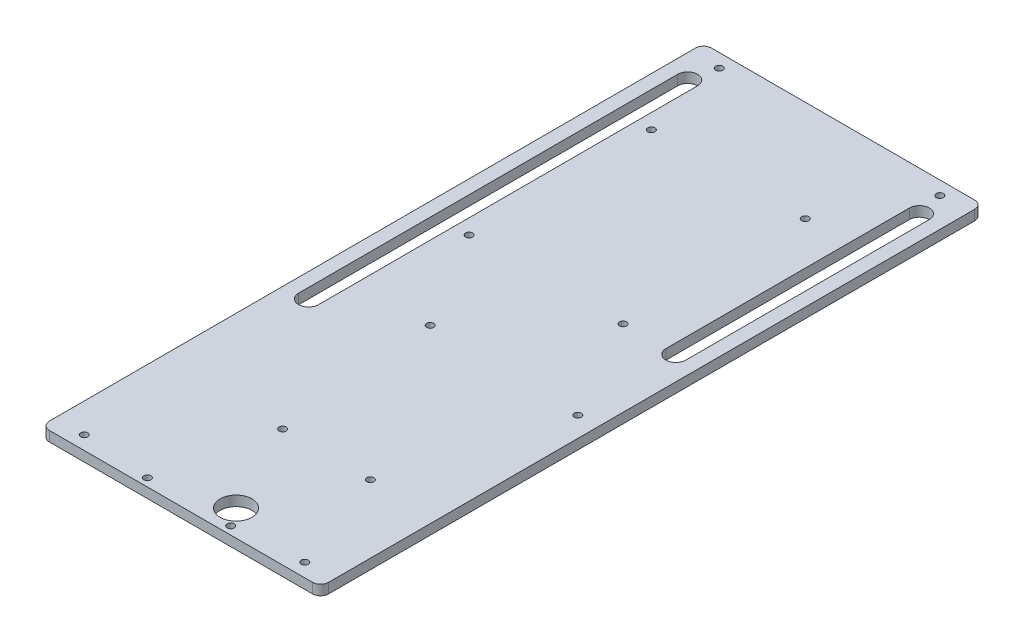
from build123d import *

# Parameters (mm, degrees)
SKETCH2_W           = 88.9
SKETCH2_H           = 3.2004
BOSS_EXTRUDE1_DEPTH = 210.82
SKETCH3_R           = 1.1303
SKETCH3_R_2         = 5.08
CUT_EXTRUDE1_DEPTH  = 216.82004684
FILLET2_R           = 2.54


with BuildPart() as part:
    # Sketch2 → Boss-Extrude1 (new body)
    with BuildSketch(Plane.XY):
        with Locations((-1.625781684, -22.993244248)):
            Rectangle(SKETCH2_W, SKETCH2_H)
    extrude(amount=BOSS_EXTRUDE1_DEPTH)

    # Sketch3 → Cut-Extrude1 (cut, through all)
    with BuildSketch(Plane(origin=(0, -21.393044248, 0), x_dir=(-1, 0, 0), z_dir=(0, 1, 0))):
        with Locations(Location((14.833781684, 208.28, 0), (0, 0, 90))):
            Circle(SKETCH3_R)
        with Locations(Location((-11.683818316, 208.28, 0), (0, 0, 90))):
            Circle(SKETCH3_R)
        with Locations(Location((-7.619818316, 202.518755316, 0), (0, 0, 90))):
            Circle(SKETCH3_R_2)
        with Locations(Location((-33.478453416, 206.502, 0), (0, 0, 90))):
            Circle(SKETCH3_R)
        with Locations(Location((36.730016784, 206.502, 0), (0, 0, 90))):
            Circle(SKETCH3_R)
        with Locations(Location((-33.478453416, 4.318, 0), (0, 0, 90))):
            Circle(SKETCH3_R)
        with Locations(Location((36.730016784, 4.318, 0), (0, 0, 90))):
            Circle(SKETCH3_R)
        with Locations(Location((-18.450986138, 32.12110162, 0), (0, 0, 90))):
            Circle(SKETCH3_R)
        with Locations(Location((-18.450986138, 90.12110162, 0), (0, 0, 90))):
            Circle(SKETCH3_R)
        with Locations(Location((30.549013862, 90.12110162, 0), (0, 0, 90))):
            Circle(SKETCH3_R)
        with Locations(Location((30.549013862, 32.12110162, 0), (0, 0, 90))):
            Circle(SKETCH3_R)
        with Locations(Location((-21.181379204, 173.304632562, 0), (0, 0, 90))):
            Circle(SKETCH3_R)
        with Locations(Location((-36.421379204, 122.504632562, 0), (0, 0, 90))):
            Circle(SKETCH3_R)
        with Locations(Location((6.758620796, 173.304632562, 0), (0, 0, 90))):
            Circle(SKETCH3_R)
        with Locations(Location((11.838620796, 121.234632562, 0), (0, 0, 90))):
            Circle(SKETCH3_R)
        with Locations((81.579081393, -113.266782514)):
            Circle(SKETCH3_R)
        with Locations((66.769810529, -163.717742064)):
            Circle(SKETCH3_R)
        with Locations((108.318194793, -113.266782514)):
            Circle(SKETCH3_R)
        with Locations((97.604440284, -108.476314785)):
            Circle(SKETCH3_R)
        with Locations((82.79516942, -158.927274335)):
            Circle(SKETCH3_R)
        with Locations((124.343553684, -108.476314785)):
            Circle(SKETCH3_R)
        with Locations((112.789811005, -158.927274335)):
            Circle(SKETCH3_R)
        with BuildLine():
            Line((35.32929924, 12.595958552), (35.32929924, 133.302587666))
            ThreePointArc((35.32929924, 133.302587666), (38.50429924, 136.477587666), (41.67929924, 133.302587666))
            Line((41.67929924, 133.302587666), (41.67929924, 12.595958552))
            ThreePointArc((41.67929924, 12.595958552), (38.50429924, 9.420958552), (35.32929924, 12.595958552))
        make_face()
        with BuildLine():
            Line((-32.077737936, 12.595958552), (-32.077737936, 90.122587598))
            ThreePointArc((-32.077737936, 90.122587598), (-35.252737936, 93.297587598), (-38.427737936, 90.122587598))
            Line((-38.427737936, 90.122587598), (-38.427737936, 12.595958552))
            ThreePointArc((-38.427737936, 12.595958552), (-35.252737936, 9.420958552), (-32.077737936, 12.595958552))
        make_face()
    extrude(amount=-CUT_EXTRUDE1_DEPTH, mode=Mode.SUBTRACT)

    # Fillet2
    fillet2_edges = [part.edges().sort_by_distance(p)[0] for p in [
        (42.824218316, -22.993244248, 210.82),
        (-46.075781684, -22.993244248, 210.82),
        (42.824218316, -22.993244248, 0),
        (-46.075781684, -22.993244248, 0),
    ]]
    fillet(fillet2_edges, radius=FILLET2_R)


solid = part.part
